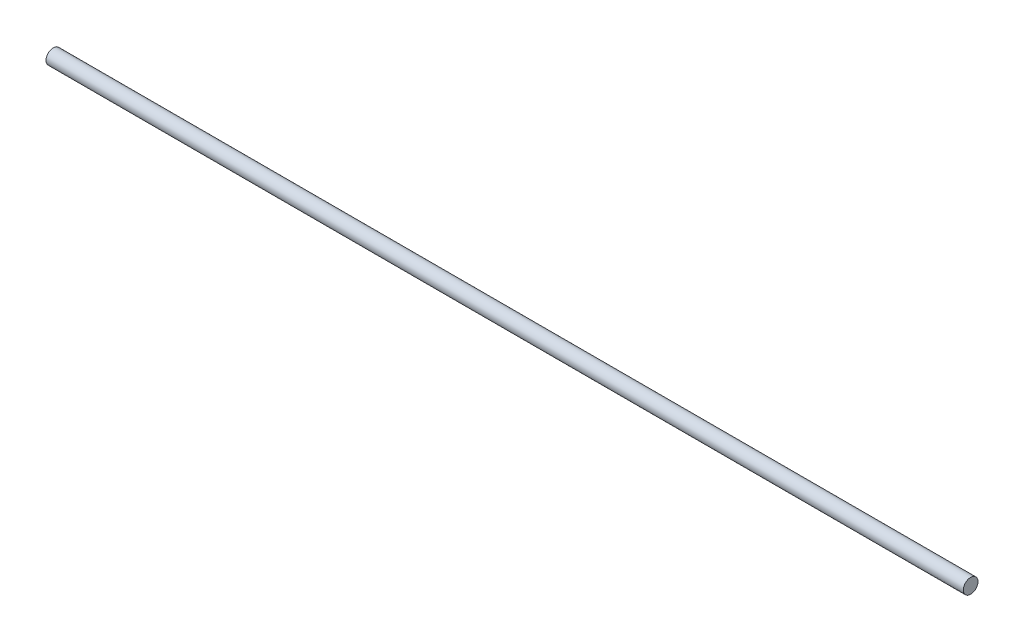
from build123d import *

# Parameters (mm, degrees)
SKETCH1_R           = 12
BOSS_EXTRUDE1_DEPTH = 1500


with BuildPart() as part:
    # Sketch1 → Boss-Extrude1 (new body)
    with BuildSketch(Plane(origin=(0, 0, 0), x_dir=(0, 0, -1), z_dir=(1, 0, 0))):
        Circle(SKETCH1_R)
    extrude(amount=BOSS_EXTRUDE1_DEPTH)


solid = part.part
